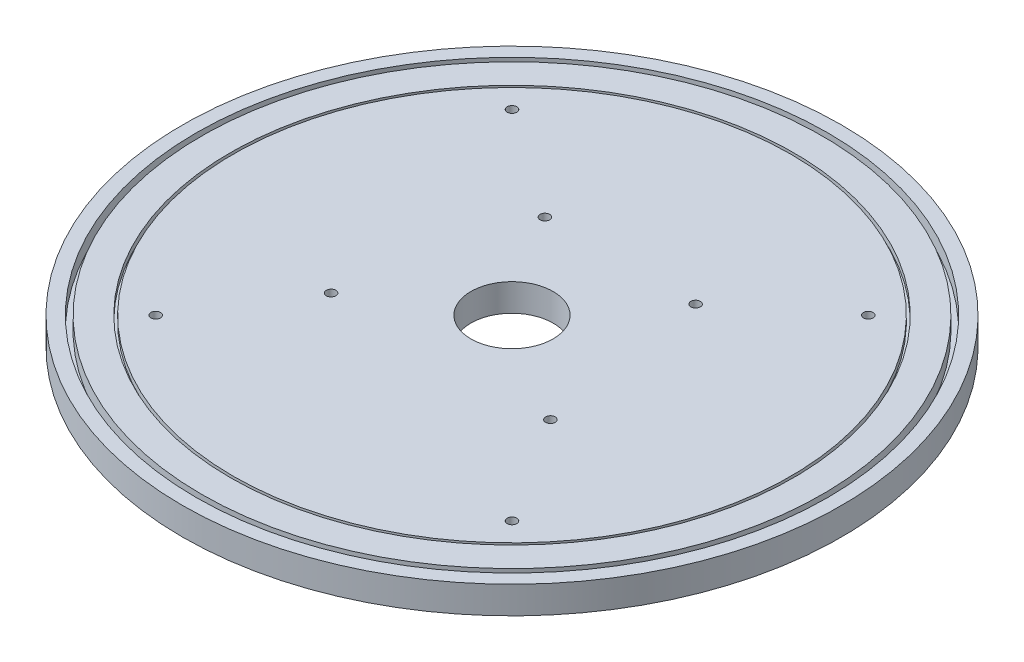
from build123d import *

# Parameters (mm, degrees)
ESQUISSE3_R             = 15
ENL_V_MAT_EXTRU_1_DEPTH = 10
ESQUISSE4_R             = 1.75
ENL_V_MAT_EXTRU_2_DEPTH = 10
ESQUISSE5_R             = 1.75
ENL_V_MAT_EXTRU_3_DEPTH = 10


with BuildPart() as part:
    # Esquisse1 → Révolution1 (revolve)
    with BuildSketch(Plane(origin=(0, 0, 0), x_dir=(0, 0, -1), z_dir=(1, 0, 0)), mode=Mode.PRIVATE) as r_volution1_sk:
        Polygon((101.754375518, 10), (101.754375518, 7.872703136), (102.754375518, 7.872703136), (102.754375518, 10), (113.254375518, 10), (113.254375518, 5), (115.25030387, 5), (115.25030387, 10), (120.254297163, 10), (120.254297163, 0), (0.004375518, 0), (0.004375518, 10), align=None)
    revolve(r_volution1_sk.sketch.rotate(Axis((0, 10, -0.004375518), (0, -1, 0)), 180), axis=Axis((0, 10, -0.004375518), (0, -1, 0)))

    # Esquisse3 → Enlèv. mat.-Extru.1 (cut)
    with BuildSketch(Plane(origin=(0, 10, 0), x_dir=(1, 0, 0), z_dir=(0, 1, 0))):
        with Locations(Location((0, 0, 0), (0, 0, 270))):
            Circle(ESQUISSE3_R)
    extrude(amount=-ENL_V_MAT_EXTRU_1_DEPTH, mode=Mode.SUBTRACT)

    # Esquisse4 → Enlèv. mat.-Extru.2 (cut)
    with BuildSketch(Plane.XZ):
        with Locations(Location((-25, -37, 0), (0, 0, 270))):
            Circle(ESQUISSE4_R)
        with Locations(Location((-40, 26, 0), (0, 0, 270))):
            Circle(ESQUISSE4_R)
        with Locations(Location((40, 26, 0), (0, 0, 270))):
            Circle(ESQUISSE4_R)
        with Locations(Location((30, -37, 0), (0, 0, 270))):
            Circle(ESQUISSE4_R)
    extrude(amount=-ENL_V_MAT_EXTRU_2_DEPTH, mode=Mode.SUBTRACT)

    # Esquisse5 → Enlèv. mat.-Extru.3 (cut)
    with BuildSketch(Plane.XZ):
        with Locations(Location((-65, 65, 0), (0, 0, 270))):
            Circle(ESQUISSE5_R)
        with Locations(Location((-65, -65, 0), (0, 0, 270))):
            Circle(ESQUISSE5_R)
        with Locations(Location((65, 65, 0), (0, 0, 270))):
            Circle(ESQUISSE5_R)
        with Locations(Location((65, -65, 0), (0, 0, 270))):
            Circle(ESQUISSE5_R)
    extrude(amount=-ENL_V_MAT_EXTRU_3_DEPTH, mode=Mode.SUBTRACT)


solid = part.part
